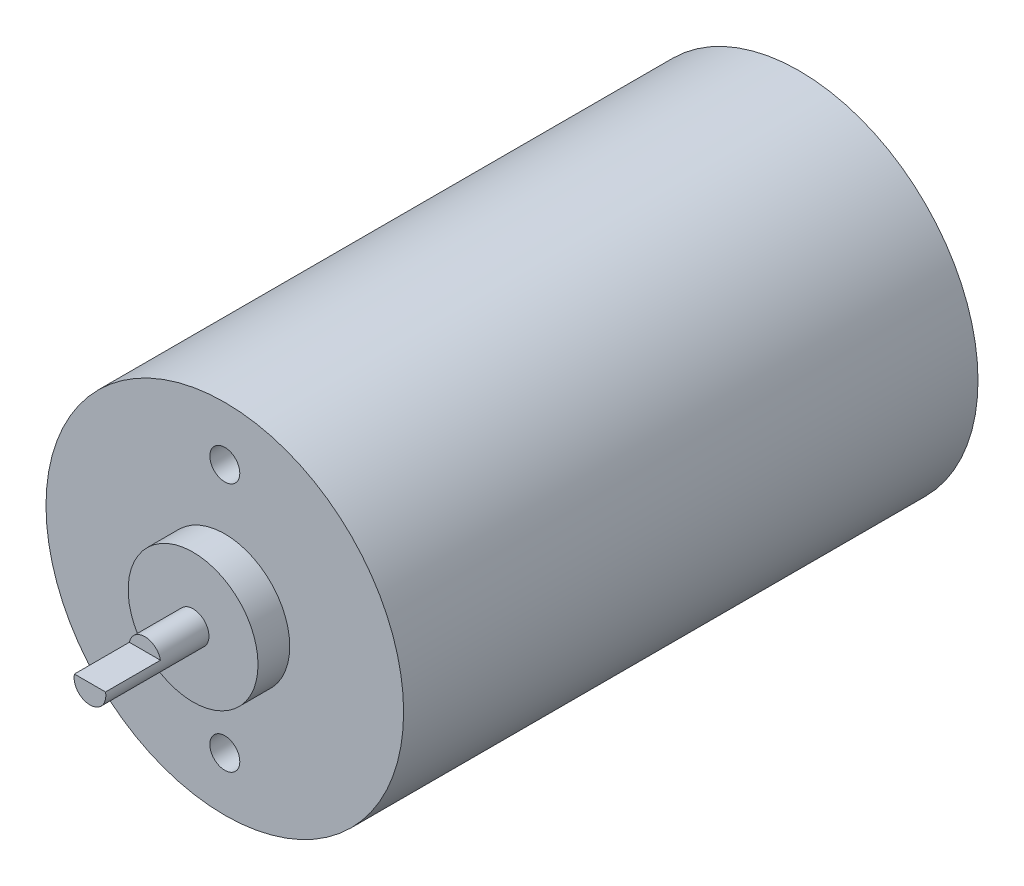
from build123d import *

# Parameters (mm, degrees)
SKETCH1_R           = 17.9
BOSS_EXTRUDE1_DEPTH = 57.5
SKETCH2_R           = 6.5
BOSS_EXTRUDE2_DEPTH = 3.175
SKETCH3_R           = 1.5875
BOSS_EXTRUDE3_DEPTH = 10.325
CUT_EXTRUDE1_DEPTH  = 5.5
SKETCH5_R           = 1.5
CUT_EXTRUDE2_DEPTH  = 5.5


with BuildPart() as part:
    # Sketch1 → Boss-Extrude1 (new body)
    with BuildSketch(Plane.XY):
        Circle(SKETCH1_R)
    extrude(amount=BOSS_EXTRUDE1_DEPTH)

    # Sketch2 → Boss-Extrude2 (add)
    with BuildSketch(Plane.XY.offset(57.5)):
        Circle(SKETCH2_R)
    extrude(amount=BOSS_EXTRUDE2_DEPTH)

    # Sketch3 → Boss-Extrude3 (add)
    with BuildSketch(Plane.XY.offset(60.675)):
        with Locations(Location((0, 0, 0), (0, 0, 180))):
            Circle(SKETCH3_R)
    extrude(amount=BOSS_EXTRUDE3_DEPTH)

    # Sketch4 → Cut-Extrude1 (cut)
    with BuildSketch(Plane.XY.offset(71)):
        with BuildLine():
            Line((-1.555064123, 0.319267636), (1.555064123, 0.319267636))
            ThreePointArc((1.555064123, 0.319267636), (0, 1.603005123), (-1.555064123, 0.319267636))
        make_face()
    extrude(amount=-CUT_EXTRUDE1_DEPTH, mode=Mode.SUBTRACT)

    # Sketch5 → Cut-Extrude2 (cut)
    with BuildSketch(Plane.XY.offset(57.5)):
        with Locations((0, 12.5)):
            Circle(SKETCH5_R)
        with Locations((0, -12.5)):
            Circle(SKETCH5_R)
    extrude(amount=-CUT_EXTRUDE2_DEPTH, mode=Mode.SUBTRACT)


solid = part.part
